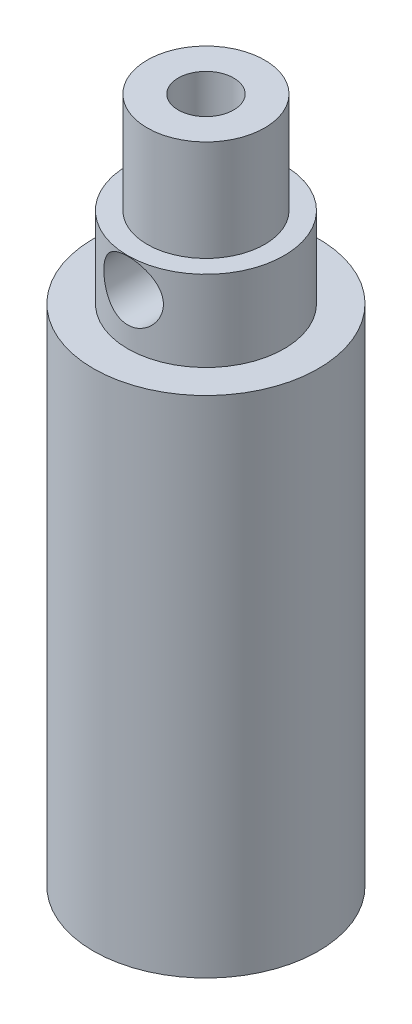
from build123d import *

# Parameters (mm, degrees)
SKETCH1_R           = 11.15
BOSS_EXTRUDE1_DEPTH = 50
SKETCH2_R           = 7.75
BOSS_EXTRUDE2_DEPTH = 8
SKETCH3_R           = 5.825
BOSS_EXTRUDE3_DEPTH = 10
SKETCH4_R           = 9.1
CUT_EXTRUDE1_DEPTH  = 35
SKETCH5_R           = 2.75
CUT_EXTRUDE2_DEPTH  = 70.804333676
SKETCH10_W          = 3
SKETCH10_H          = 11.4427922
BOSS_EXTRUDE5_DEPTH = 6
SKETCH12_W          = 6
SKETCH12_H          = 1
CUT_EXTRUDE6_DEPTH  = 6
CUT_EXTRUDE8_DEPTH  = 18
SKETCH14_W          = 6
SKETCH14_H          = 10.4427922
CUT_EXTRUDE9_DEPTH  = 8


with BuildPart() as part:
    # Sketch1 → Boss-Extrude1 (new body)
    with BuildSketch(Plane(origin=(0, 0, 0), x_dir=(1, 0, 0), z_dir=(0, 1, 0))):
        with Locations(Location((0, 0, 0), (0, 0, 270))):
            Circle(SKETCH1_R)
    extrude(amount=BOSS_EXTRUDE1_DEPTH)

    # Sketch2 → Boss-Extrude2 (add)
    with BuildSketch(Plane(origin=(0, 50, 0), x_dir=(1, 0, 0), z_dir=(0, 1, 0))):
        with Locations(Location((0, 0, 0), (0, 0, 270))):
            Circle(SKETCH2_R)
    extrude(amount=BOSS_EXTRUDE2_DEPTH)

    # Sketch3 → Boss-Extrude3 (add)
    with BuildSketch(Plane(origin=(0, 58, 0), x_dir=(1, 0, 0), z_dir=(0, 1, 0))):
        with Locations(Location((0, 0, 0), (0, 0, 270))):
            Circle(SKETCH3_R)
    extrude(amount=BOSS_EXTRUDE3_DEPTH)

    # Sketch4 → Cut-Extrude1 (cut)
    with BuildSketch(Plane.XZ):
        with Locations(Location((0, 0, 0), (0, 0, 270))):
            Circle(SKETCH4_R)
    extrude(amount=-CUT_EXTRUDE1_DEPTH, mode=Mode.SUBTRACT)

    # Sketch5 → Cut-Extrude2 (cut, through all)
    with BuildSketch(Plane(origin=(0, 68, 0), x_dir=(1, 0, 0), z_dir=(0, 1, 0))):
        with Locations(Location((0, 0, 0), (0, 0, 270))):
            Circle(SKETCH5_R)
    extrude(amount=-CUT_EXTRUDE2_DEPTH, mode=Mode.SUBTRACT)


with BuildPart() as body_2:
    # Sketch10 → Boss-Extrude5 (new body)
    with BuildSketch(Plane(origin=(0, 58, 0), x_dir=(1, 0, 0), z_dir=(0, 1, 0))):
        with Locations((-1.5, -13.4713961)):
            Rectangle(SKETCH10_W, SKETCH10_H)
        with Locations((1.5, -13.4713961)):
            Rectangle(SKETCH10_W, SKETCH10_H)
    extrude(amount=-BOSS_EXTRUDE5_DEPTH)

    # Sketch12 → Cut-Extrude6 (cut)
    with BuildSketch(Plane(origin=(0, 58, 0), x_dir=(1, 0, 0), z_dir=(0, 1, 0))):
        with Locations((0, -8.25)):
            Rectangle(SKETCH12_W, SKETCH12_H)
    extrude(amount=-CUT_EXTRUDE6_DEPTH, mode=Mode.SUBTRACT)


with BuildPart() as cut_extrude8_tool:
    # Sketch11 → Cut-Extrude8 (new body)
    with BuildSketch(Plane.XY.offset(19.1927922)):
        with BuildLine():
            ThreePointArc((2.95, 55), (0, 57.95), (-2.95, 55))
            Line((-2.95, 55), (2.95, 55))
        make_face()
        with BuildLine():
            Line((2.95, 55), (-2.95, 55))
            ThreePointArc((-2.95, 55), (0, 52.05), (2.95, 55))
        make_face()
    extrude(amount=-CUT_EXTRUDE8_DEPTH)


with BuildPart() as part_1:
    add(part.part)

    # Cut-Extrude8: cut by cut_extrude8_tool
    add(cut_extrude8_tool.part, mode=Mode.SUBTRACT)


with BuildPart() as body_2_1:
    add(body_2.part)

    # Cut-Extrude8: cut by cut_extrude8_tool
    add(cut_extrude8_tool.part, mode=Mode.SUBTRACT)

    # Sketch14 → Cut-Extrude9 (cut)
    with BuildSketch(Plane(origin=(0, 58, 0), x_dir=(1, 0, 0), z_dir=(0, 1, 0))):
        with Locations((0, -13.9713961)):
            Rectangle(SKETCH14_W, SKETCH14_H)
    extrude(amount=-CUT_EXTRUDE9_DEPTH, mode=Mode.SUBTRACT)


solid = part_1.part
